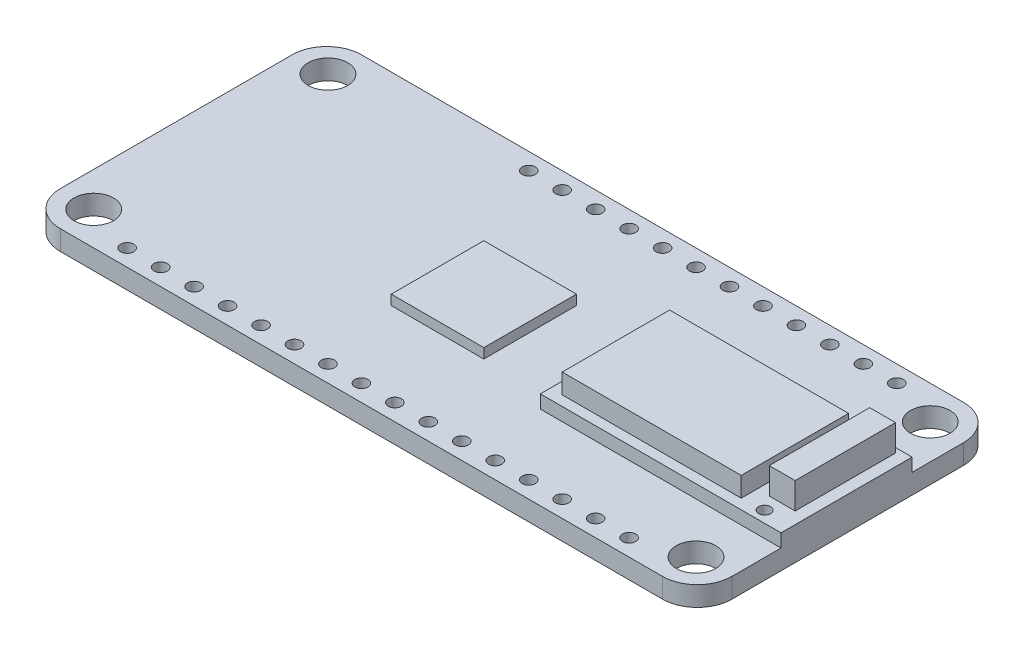
from build123d import *

# Parameters (mm, degrees)
SKETCH1_R           = 0.5
SKETCH1_R_2         = 1.5
BOSS_EXTRUDE1_DEPTH = 1.5
SKETCH3_W           = 13.585431646
SKETCH3_H           = 8.151258988
BOSS_EXTRUDE2_DEPTH = 2.5
SKETCH4_W           = 1.964423464
SKETCH4_H           = 7.620608266
BOSS_EXTRUDE3_DEPTH = 3
SKETCH5_W           = 18.269857108
SKETCH5_H           = 9.951352814
SKETCH5_R           = 0.457577412
BOSS_EXTRUDE4_DEPTH = 1
SKETCH6_W           = 7.030512295
SKETCH6_H           = 7.030512295
BOSS_EXTRUDE5_DEPTH = 0.75


with BuildPart() as part:
    # Sketch1 → Boss-Extrude1 (new body)
    with BuildSketch(Plane(origin=(0, 0, 0), x_dir=(1, 0, 0), z_dir=(0, 1, 0))):
        with BuildLine():
            Line((2.63, 0), (48.35, 0))
            ThreePointArc((48.35, 0), (50.209690835, -0.770309165), (50.98, -2.63))
            Line((50.98, -2.63), (50.98, -20.23))
            ThreePointArc((50.98, -20.23), (50.209690835, -22.089690835), (48.35, -22.86))
            Line((48.35, -22.86), (2.63, -22.86))
            ThreePointArc((2.63, -22.86), (0.770309165, -22.089690835), (0, -20.23))
            Line((0, -20.23), (0, -2.63))
            ThreePointArc((0, -2.63), (0.770309165, -0.770309165), (2.63, 0))
        make_face()
        with Locations(Location((6.44, -21.59, 0), (0, 0, 270))):
            Circle(SKETCH1_R, mode=Mode.SUBTRACT)
        with Locations(Location((8.98, -21.59, 0), (0, 0, 270))):
            Circle(SKETCH1_R, mode=Mode.SUBTRACT)
        with Locations(Location((11.52, -21.59, 0), (0, 0, 270))):
            Circle(SKETCH1_R, mode=Mode.SUBTRACT)
        with Locations(Location((14.06, -21.59, 0), (0, 0, 270))):
            Circle(SKETCH1_R, mode=Mode.SUBTRACT)
        with Locations(Location((16.6, -21.59, 0), (0, 0, 270))):
            Circle(SKETCH1_R, mode=Mode.SUBTRACT)
        with Locations(Location((19.14, -21.59, 0), (0, 0, 270))):
            Circle(SKETCH1_R, mode=Mode.SUBTRACT)
        with Locations(Location((21.68, -21.59, 0), (0, 0, 270))):
            Circle(SKETCH1_R, mode=Mode.SUBTRACT)
        with Locations(Location((24.22, -21.59, 0), (0, 0, 270))):
            Circle(SKETCH1_R, mode=Mode.SUBTRACT)
        with Locations(Location((26.76, -21.59, 0), (0, 0, 270))):
            Circle(SKETCH1_R, mode=Mode.SUBTRACT)
        with Locations(Location((29.3, -21.59, 0), (0, 0, 270))):
            Circle(SKETCH1_R, mode=Mode.SUBTRACT)
        with Locations(Location((31.84, -21.59, 0), (0, 0, 270))):
            Circle(SKETCH1_R, mode=Mode.SUBTRACT)
        with Locations(Location((34.38, -21.59, 0), (0, 0, 270))):
            Circle(SKETCH1_R, mode=Mode.SUBTRACT)
        with Locations(Location((36.92, -21.59, 0), (0, 0, 270))):
            Circle(SKETCH1_R, mode=Mode.SUBTRACT)
        with Locations(Location((39.46, -21.59, 0), (0, 0, 270))):
            Circle(SKETCH1_R, mode=Mode.SUBTRACT)
        with Locations(Location((42, -21.59, 0), (0, 0, 270))):
            Circle(SKETCH1_R, mode=Mode.SUBTRACT)
        with Locations(Location((44.54, -21.59, 0), (0, 0, 270))):
            Circle(SKETCH1_R, mode=Mode.SUBTRACT)
        with Locations(Location((44.54, -1.27, 0), (0, 0, 270))):
            Circle(SKETCH1_R, mode=Mode.SUBTRACT)
        with Locations(Location((42, -1.27, 0), (0, 0, 270))):
            Circle(SKETCH1_R, mode=Mode.SUBTRACT)
        with Locations(Location((39.46, -1.27, 0), (0, 0, 270))):
            Circle(SKETCH1_R, mode=Mode.SUBTRACT)
        with Locations(Location((36.92, -1.27, 0), (0, 0, 270))):
            Circle(SKETCH1_R, mode=Mode.SUBTRACT)
        with Locations(Location((34.38, -1.27, 0), (0, 0, 270))):
            Circle(SKETCH1_R, mode=Mode.SUBTRACT)
        with Locations(Location((31.84, -1.27, 0), (0, 0, 270))):
            Circle(SKETCH1_R, mode=Mode.SUBTRACT)
        with Locations(Location((29.3, -1.27, 0), (0, 0, 270))):
            Circle(SKETCH1_R, mode=Mode.SUBTRACT)
        with Locations(Location((26.76, -1.27, 0), (0, 0, 270))):
            Circle(SKETCH1_R, mode=Mode.SUBTRACT)
        with Locations(Location((24.22, -1.27, 0), (0, 0, 270))):
            Circle(SKETCH1_R, mode=Mode.SUBTRACT)
        with Locations(Location((21.68, -1.27, 0), (0, 0, 270))):
            Circle(SKETCH1_R, mode=Mode.SUBTRACT)
        with Locations(Location((19.14, -1.27, 0), (0, 0, 270))):
            Circle(SKETCH1_R, mode=Mode.SUBTRACT)
        with Locations(Location((16.6, -1.27, 0), (0, 0, 270))):
            Circle(SKETCH1_R, mode=Mode.SUBTRACT)
        with Locations(Location((2.63, -2.54, 0), (0, 0, 270))):
            Circle(SKETCH1_R_2, mode=Mode.SUBTRACT)
        with Locations(Location((2.63, -20.32, 0), (0, 0, 270))):
            Circle(SKETCH1_R_2, mode=Mode.SUBTRACT)
        with Locations(Location((48.35, -20.32, 0), (0, 0, 270))):
            Circle(SKETCH1_R_2, mode=Mode.SUBTRACT)
        with Locations(Location((48.35, -2.54, 0), (0, 0, 270))):
            Circle(SKETCH1_R_2, mode=Mode.SUBTRACT)
    extrude(amount=BOSS_EXTRUDE1_DEPTH)

    # Sketch3 → Boss-Extrude2 (add)
    with BuildSketch(Plane(origin=(0, 1.5, 0), x_dir=(1, 0, 0), z_dir=(0, 1, 0))):
        with Locations((40.399579876, -11.65885309)):
            Rectangle(SKETCH3_W, SKETCH3_H)
    extrude(amount=BOSS_EXTRUDE2_DEPTH)

    # Sketch4 → Boss-Extrude3 (add)
    with BuildSketch(Plane(origin=(0, 1.5, 0), x_dir=(1, 0, 0), z_dir=(0, 1, 0))):
        with Locations((49.100080702, -10.717871328)):
            Rectangle(SKETCH4_W, SKETCH4_H)
    extrude(amount=BOSS_EXTRUDE3_DEPTH)

    # Sketch5 → Boss-Extrude4 (add)
    with BuildSketch(Plane(origin=(0, 1.5, 0), x_dir=(1, 0, 0), z_dir=(0, 1, 0))):
        with Locations((41.845071446, -11.523458661)):
            Rectangle(SKETCH5_W, SKETCH5_H)
        with Locations(Location((48.865489617, -15.632765099, 0), (0, 0, 270))):
            Circle(SKETCH5_R, mode=Mode.SUBTRACT)
    extrude(amount=BOSS_EXTRUDE4_DEPTH)

    # Sketch6 → Boss-Extrude5 (add)
    with BuildSketch(Plane(origin=(0, 1.5, 0), x_dir=(1, 0, 0), z_dir=(0, 1, 0))):
        with Locations((23.761662883, -11.839547187)):
            Rectangle(SKETCH6_W, SKETCH6_H)
    extrude(amount=BOSS_EXTRUDE5_DEPTH)


solid = part.part
